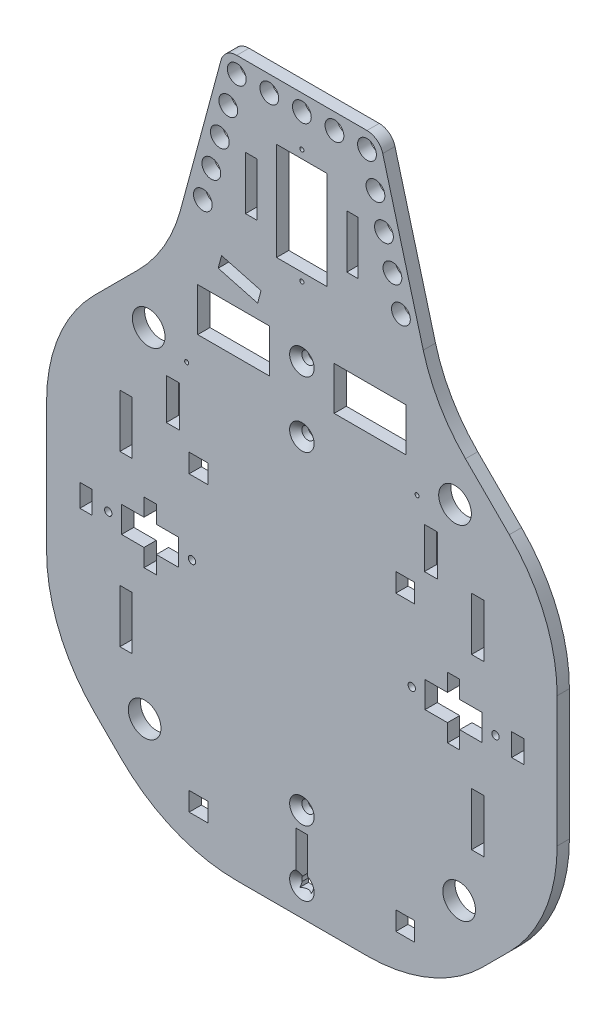
from build123d import *

# Parameters (mm, degrees)
SKICA1_R                 = 0.5
SKICA1_R_2               = 2.3
SKICA1_R_3               = 0.9
SKICA1_W                 = 3
SKICA1_H                 = 13
SKICA1_H_2               = 5.5
SKICA1_W_2               = 17.6
SKICA1_H_3               = 10.6
SKICA1_W_3               = 12.4
SKICA1_H_4               = 24
SKICA1_W_4               = 2.8
SKICA1_W_5               = 3.2
SKICA1_H_5               = 10
SKICA1_W_6               = 4.6
SKICA1_H_6               = 4.6
P_IDAT_VYSUNUT_M1_DEPTH  = 3
SKICA2_R                 = 1.5
ODEBRAT_VYSUNUT_M1_DEPTH = 3
ZKOSEN_1_SIZE            = 1.5
ZAOBLIT1_R               = 40
ZAOBLIT2_R               = 4
SKICA3_R                 = 0.5
SKICA3_W                 = 2.8
SKICA3_H                 = 13
ODEBRAT_VYSUNUT_M2_DEPTH = 129.730338305
SKICA7_R                 = 4
ODEBRAT_VYSUNUT_M3_DEPTH = 129.730338305


with BuildPart() as part:
    # Skica1 → Přidat vysunutím1 (new body)
    with BuildSketch(Plane.XY):
        Polygon((-62.5, -32.5), (-62.5, 32.5), (-32.5, 62.5), (-19.003438856, 112.5), (19.003438856, 112.5), (32.5, 62.5), (62.5, 32.5), (62.5, -32.5), (32.5, -62.5), (-32.5, -62.5), align=None)
        with Locations((0, 100.5)):
            Circle(SKICA1_R, mode=Mode.SUBTRACT)
        with Locations(Location((0, 72.5, 0), (0, 0, 180))):
            Circle(SKICA1_R, mode=Mode.SUBTRACT)
        with Locations((0, 108.5)):
            Circle(SKICA1_R_2, mode=Mode.SUBTRACT)
        with Locations((7.97, 108.5)):
            Circle(SKICA1_R_2, mode=Mode.SUBTRACT)
        with Locations((15.94, 108.5)):
            Circle(SKICA1_R_2, mode=Mode.SUBTRACT)
        with Locations(Location((-15.94, 108.5, 0), (0, 0, 180))):
            Circle(SKICA1_R_2, mode=Mode.SUBTRACT)
        with Locations(Location((-7.97, 108.5, 0), (0, 0, 180))):
            Circle(SKICA1_R_2, mode=Mode.SUBTRACT)
        with Locations(Location((-18.017013584, 100.805397049, 0), (0, 0, 180))):
            Circle(SKICA1_R_2, mode=Mode.SUBTRACT)
        with Locations((-20.094027168, 93.110794098)):
            Circle(SKICA1_R_2, mode=Mode.SUBTRACT)
        with Locations((-22.171040752, 85.416191147)):
            Circle(SKICA1_R_2, mode=Mode.SUBTRACT)
        with Locations((-24.248054336, 77.721588196)):
            Circle(SKICA1_R_2, mode=Mode.SUBTRACT)
        with Locations(Location((24.248054336, 77.721588196, 0), (0, 0, 180))):
            Circle(SKICA1_R_2, mode=Mode.SUBTRACT)
        with Locations(Location((22.171040752, 85.416191147, 0), (0, 0, 180))):
            Circle(SKICA1_R_2, mode=Mode.SUBTRACT)
        with Locations(Location((20.094027168, 93.110794098, 0), (0, 0, 180))):
            Circle(SKICA1_R_2, mode=Mode.SUBTRACT)
        with Locations((18.017013584, 100.805397049)):
            Circle(SKICA1_R_2, mode=Mode.SUBTRACT)
        with Locations((47.397781356, 0)):
            Circle(SKICA1_R_3, mode=Mode.SUBTRACT)
        with Locations(Location((26.897781356, 0, 0), (0, 0, 180))):
            Circle(SKICA1_R_3, mode=Mode.SUBTRACT)
        with Locations(Location((-47.397781356, 0, 0), (0, 0, 180))):
            Circle(SKICA1_R_3, mode=Mode.SUBTRACT)
        with Locations((-26.897781356, 0)):
            Circle(SKICA1_R_3, mode=Mode.SUBTRACT)
        Polygon((-44.147781356, 3.2), (-38.647781356, 3.2), (-38.647781356, 7.5), (-35.647781356, 7.5), (-35.647781356, 3.2), (-30.147781356, 3.2), (-30.147781356, -3.2), (-35.647781356, -3.2), (-35.647781356, -7.5), (-38.647781356, -7.5), (-38.647781356, -3.2), (-44.147781356, -3.2), align=None, mode=Mode.SUBTRACT)
        with Locations((-43.047781356, 20.7)):
            Rectangle(SKICA1_W, SKICA1_H, mode=Mode.SUBTRACT)
        with Locations((-52.847781356, 0)):
            Rectangle(SKICA1_W, SKICA1_H_2, mode=Mode.SUBTRACT)
        with Locations((-43.047781356, -20.7)):
            Rectangle(SKICA1_W, SKICA1_H, mode=Mode.SUBTRACT)
        Polygon((38.647781356, -7.5), (35.647781356, -7.5), (35.647781356, -3.2), (30.147781356, -3.2), (30.147781356, 3.2), (35.647781356, 3.2), (35.647781356, 7.5), (38.647781356, 7.5), (38.647781356, 3.2), (44.147781356, 3.2), (44.147781356, -3.2), (38.647781356, -3.2), align=None, mode=Mode.SUBTRACT)
        with Locations((52.847781356, 0)):
            Rectangle(SKICA1_W, SKICA1_H_2, mode=Mode.SUBTRACT)
        with Locations((43.047781356, 20.7)):
            Rectangle(SKICA1_W, SKICA1_H, mode=Mode.SUBTRACT)
        with Locations((43.047781356, -20.7)):
            Rectangle(SKICA1_W, SKICA1_H, mode=Mode.SUBTRACT)
        with Locations((16.7, 53.8)):
            Rectangle(SKICA1_W_2, SKICA1_H_3, mode=Mode.SUBTRACT)
        with Locations((-16.7, 53.8)):
            Rectangle(SKICA1_W_2, SKICA1_H_3, mode=Mode.SUBTRACT)
        with Locations((0, 86.5)):
            Rectangle(SKICA1_W_3, SKICA1_H_4, mode=Mode.SUBTRACT)
        with Locations((-12.4, 86.5)):
            Rectangle(SKICA1_W_4, SKICA1_H, mode=Mode.SUBTRACT)
        Polygon((-20.487479207, 65.088190451), (-10.828220944, 62.5), (-10, 65.590962644), (-19.659258263, 68.179153095), align=None, mode=Mode.SUBTRACT)
        with Locations((12.4, 86.5)):
            Rectangle(SKICA1_W_4, SKICA1_H, mode=Mode.SUBTRACT)
        with Locations((31.6, 31)):
            Rectangle(SKICA1_W_5, SKICA1_H_5, mode=Mode.SUBTRACT)
        with Locations((-31.6, 31)):
            Rectangle(SKICA1_W_5, SKICA1_H_5, mode=Mode.SUBTRACT)
        with Locations((25.3, 20.23)):
            Rectangle(SKICA1_W_6, SKICA1_H_6, mode=Mode.SUBTRACT)
        with Locations((25.3, -51.5)):
            Rectangle(SKICA1_W_6, SKICA1_H_6, mode=Mode.SUBTRACT)
        with Locations((-25.3, -51.5)):
            Rectangle(SKICA1_W_6, SKICA1_H_6, mode=Mode.SUBTRACT)
        with Locations((-25.3, 20.23)):
            Rectangle(SKICA1_W_6, SKICA1_H_6, mode=Mode.SUBTRACT)
    extrude(amount=P_IDAT_VYSUNUT_M1_DEPTH)

    # Skica2 → Odebrat vysunutím1 (cut)
    with BuildSketch(Plane.XY):
        with Locations(Location((0, 39.6, 0), (0, 0, 180))):
            Circle(SKICA2_R)
        with Locations(Location((0, 55.6, 0), (0, 0, 180))):
            Circle(SKICA2_R)
        with Locations(Location((0, -55.6, 0), (0, 0, 180))):
            Circle(SKICA2_R)
        with Locations(Location((0, -39.6, 0), (0, 0, 180))):
            Circle(SKICA2_R)
    extrude(amount=ODEBRAT_VYSUNUT_M1_DEPTH, mode=Mode.SUBTRACT)

    # Zkosení1
    zkosen_1_edges = [part.edges().sort_by_distance(p)[0] for p in [
        (1.5, 55.6, 3),
        (1.5, -55.6, 3),
        (1.5, -39.6, 3),
        (1.5, 39.6, 3),
    ]]
    chamfer(zkosen_1_edges, length=ZKOSEN_1_SIZE)

    # Zaoblit1
    zaoblit1_edges = [part.edges().sort_by_distance(p)[0] for p in [
        (-62.5, -32.5, 1.5),
        (-62.5, 32.5, 1.5),
        (-32.5, 62.5, 1.5),
        (32.5, 62.5, 1.5),
        (62.5, 32.5, 1.5),
        (62.5, -32.5, 1.5),
        (32.5, -62.5, 1.5),
        (-32.5, -62.5, 1.5),
    ]]
    fillet(zaoblit1_edges, radius=ZAOBLIT1_R)

    # Zaoblit2
    zaoblit2_edges = [part.edges().sort_by_distance(p)[0] for p in [
        (-19.003438856, 112.5, 1.5),
        (19.003438856, 112.5, 1.5),
    ]]
    fillet(zaoblit2_edges, radius=ZAOBLIT2_R)

    # Skica3 → Odebrat vysunutím2 (cut, through all)
    with BuildSketch(Plane.XY.offset(3)):
        with Locations((-28.2, 41.3)):
            Circle(SKICA3_R)
        with Locations(Location((28.2, 41.3, 0), (0, 0, 180))):
            Circle(SKICA3_R)
        with Locations((0, -50.6)):
            Rectangle(SKICA3_W, SKICA3_H)
    extrude(amount=-ODEBRAT_VYSUNUT_M2_DEPTH, mode=Mode.SUBTRACT)

    # Skica7 → Odebrat vysunutím3 (cut, through all)
    with BuildSketch(Plane.XY.offset(3)):
        with Locations((-38.5, -39.5)):
            Circle(SKICA7_R)
        with Locations((38.5, -39.5)):
            Circle(SKICA7_R)
        with Locations((-37.5, 44)):
            Circle(SKICA7_R)
        with Locations((37.5, 44)):
            Circle(SKICA7_R)
    extrude(amount=-ODEBRAT_VYSUNUT_M3_DEPTH, mode=Mode.SUBTRACT)


solid = part.part
